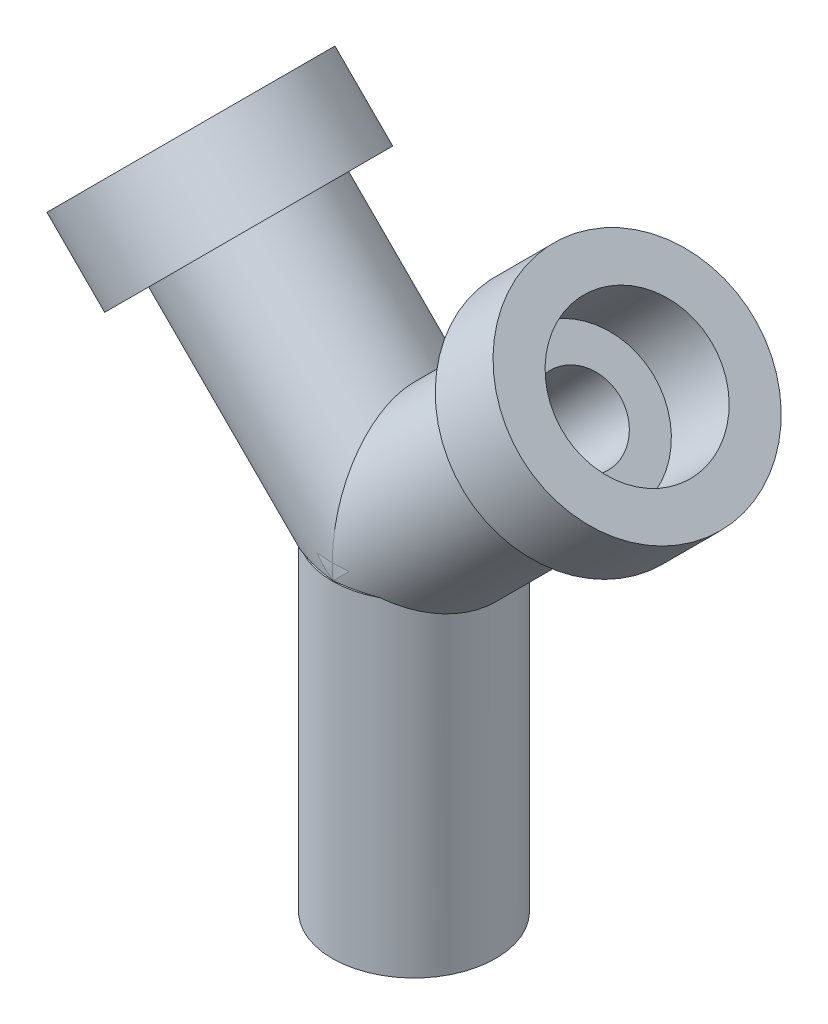
from build123d import *

# Parameters (mm, degrees)
SKETCH3_W          = 6.35
SKETCH3_H          = 25.4
SKETCH4_R          = 3.175
CUT_EXTRUDE1_DEPTH = 19.05
SKETCH6_R          = 3.175
CUT_EXTRUDE2_DEPTH = 25.4


with BuildPart() as part:
    # Sketch2 → Revolve1 (revolve)
    with BuildSketch(Plane.XY, mode=Mode.PRIVATE) as revolve1_sk:
        Polygon((5.230557596, 5.79531338), (1.09963978, 9.926231195), (5.589767841, 14.416359256), (3.254901249, 16.751225847), (-1.235226811, 12.261097787), (0.740429535, 10.28544144), (-12.729954646, -3.184942741), (-8.239826586, -7.675070802), align=None)
    revolve1 = revolve(revolve1_sk.sketch.rotate(Axis((-8.239826586, -7.675070802, 0), (0.7071067811865436, 0.7071067811865516, 0)), 180), axis=Axis((-8.239826586, -7.675070802, 0), (0.7071067811865436, 0.7071067811865516, 0)))

    # Mirror1: Revolve1 across plane
    add(revolve1.mirror(Plane(origin=(-7.62, 0, 0), x_dir=(0, 0, 1), z_dir=(1, 0, 0))))

    # Sketch3 → Revolve2 (revolve)
    with BuildSketch(Plane.XY, mode=Mode.PRIVATE) as revolve2_sk:
        with Locations((-4.445, -20.994897388)):
            Rectangle(SKETCH3_W, SKETCH3_H)
    revolve(revolve2_sk.sketch.rotate(Axis((-7.62, -8.294897388, 0), (0, -1, 0)), 90), axis=Axis((-7.62, -8.294897388, 0), (0, -1, 0)))

    # Sketch4 → Cut-Extrude1 (cut)
    with BuildSketch(Plane(origin=(-13.132935488, 13.132935488, 0), x_dir=(0, 0, 1), z_dir=(-0.7071067811865437, 0.7071067811865515, 0))):
        with Locations(Location((0, -10.376964701, 0), (0, 0, 270))):
            Circle(SKETCH4_R)
    cut_extrude1 = extrude(amount=-CUT_EXTRUDE1_DEPTH, mode=Mode.SUBTRACT)

    # Mirror2: Cut-Extrude1 across plane
    add(cut_extrude1.mirror(Plane(origin=(-7.62, 0, 0), x_dir=(0, 0, 1), z_dir=(1, 0, 0))), mode=Mode.SUBTRACT)

    # Sketch6 → Cut-Extrude2 (cut)
    with BuildSketch(Plane.XZ.offset(33.694897388)):
        with Locations(Location((-7.62, 0, 0), (0, 0, 270))):
            Circle(SKETCH6_R)
    extrude(amount=-CUT_EXTRUDE2_DEPTH, mode=Mode.SUBTRACT)


solid = part.part
